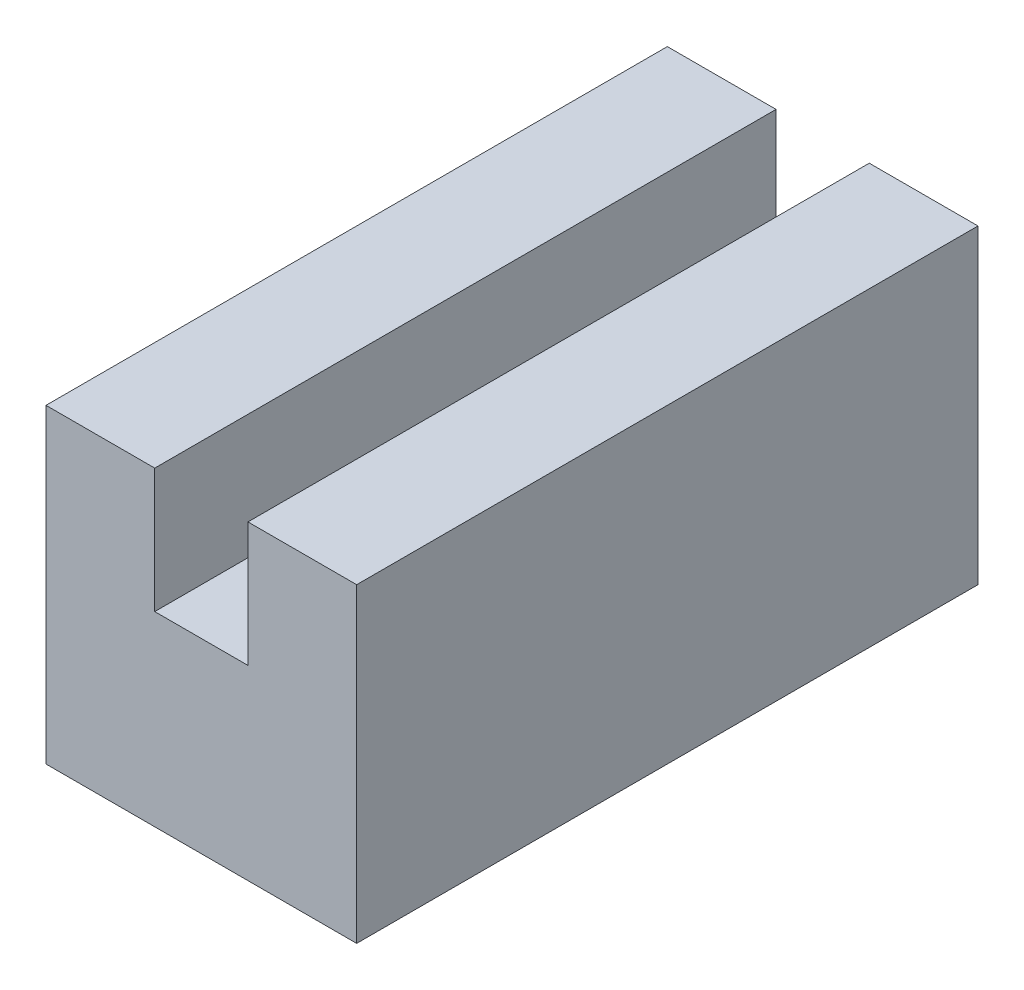
from build123d import *

# Parameters (mm, degrees)
SKETCH1_W           = 5
SKETCH1_H           = 5
BOSS_EXTRUDE1_DEPTH = 10
SKETCH2_W           = 1.5
SKETCH2_H           = 10
CUT_EXTRUDE1_DEPTH  = 2


with BuildPart() as part:
    # Sketch1 → Boss-Extrude1 (new body)
    with BuildSketch(Plane.XY):
        with Locations((2.5, 2.5)):
            Rectangle(SKETCH1_W, SKETCH1_H)
    extrude(amount=BOSS_EXTRUDE1_DEPTH)

    # Sketch2 → Cut-Extrude1 (cut)
    with BuildSketch(Plane(origin=(0, 5, 0), x_dir=(1, 0, 0), z_dir=(0, 1, 0))):
        with Locations((2.5, -5)):
            Rectangle(SKETCH2_W, SKETCH2_H)
    extrude(amount=-CUT_EXTRUDE1_DEPTH, mode=Mode.SUBTRACT)


solid = part.part
